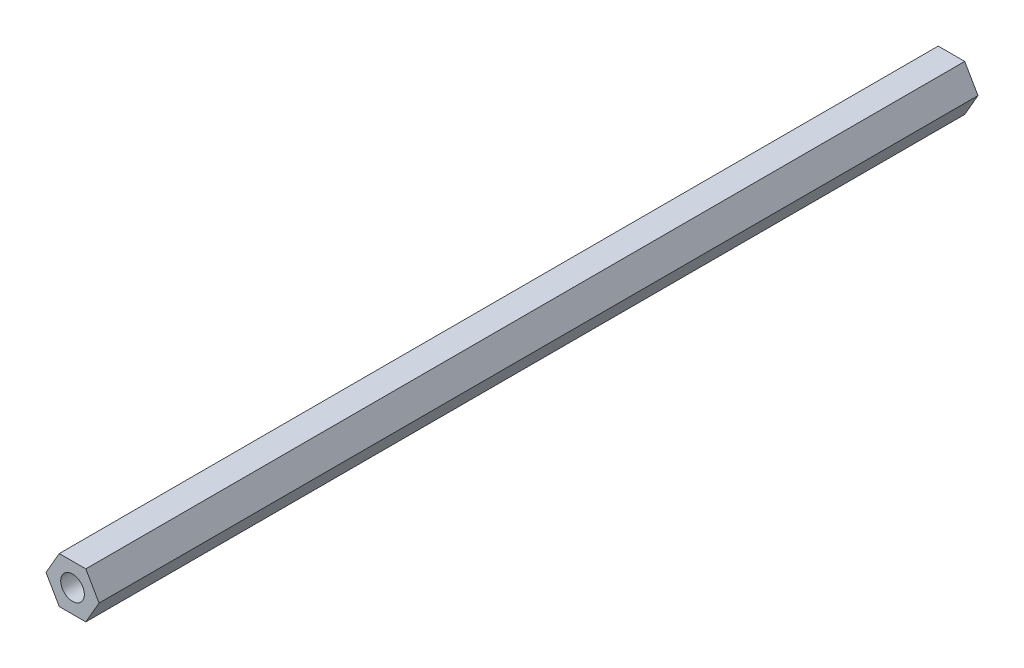
from build123d import *

# Parameters (mm, degrees)
SKETCH1_R           = 3.2639
BOSS_EXTRUDE1_DEPTH = 242.8875


with BuildPart() as part:
    # Sketch1 → Boss-Extrude1 (new body)
    with BuildSketch(Plane.XY):
        Polygon((-3.666174209, 6.35), (-7.332348419, 0), (-3.666174209, -6.35), (3.666174209, -6.35), (7.332348419, 0), (3.666174209, 6.35), align=None)
        Circle(SKETCH1_R, mode=Mode.SUBTRACT)
    extrude(amount=BOSS_EXTRUDE1_DEPTH)


solid = part.part
